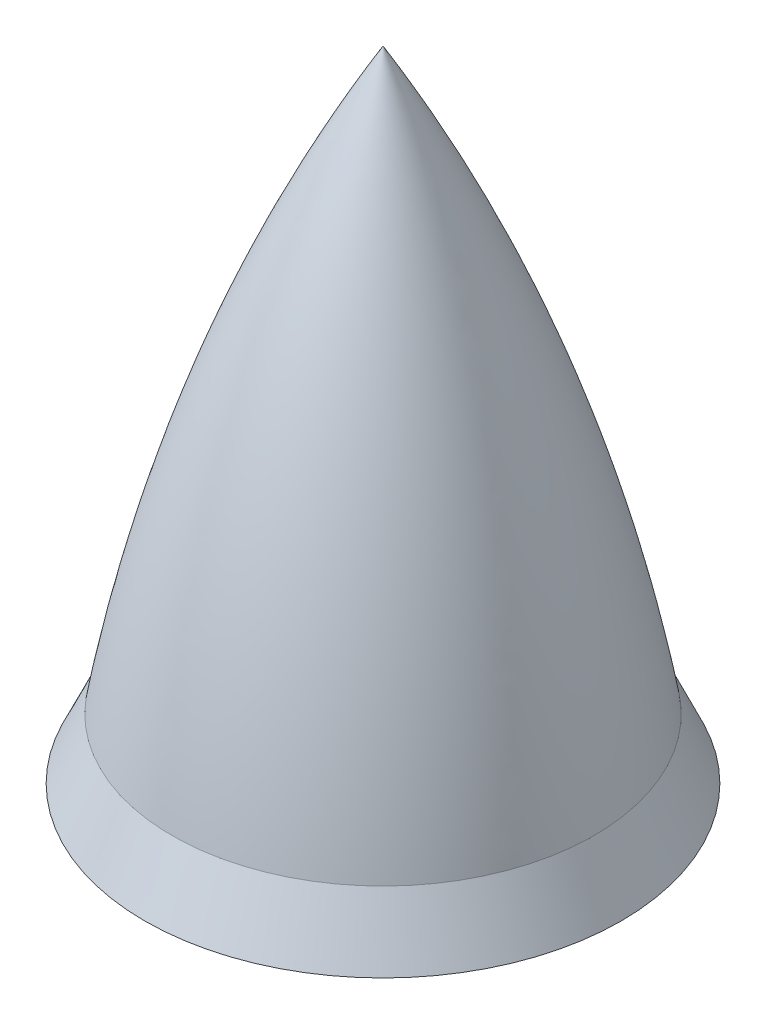
from build123d import *

# Parameters (mm, degrees)
SKETCH2_R          = 2.5
CUT_EXTRUDE1_DEPTH = 5


with BuildPart() as part:
    # Sketch1 → Revolve2 (revolve)
    with BuildSketch(Plane.XY, mode=Mode.PRIVATE) as revolve2_sk:
        with BuildLine():
            Line((0, 0), (-5.93, 0))
            Line((-5.93, 0), (-5.25, 1.5))
            ThreePointArc((-5.25, 1.5), (-3.264641046, 8.933202465), (0, 15.9))
            Line((0, 15.9), (0, 1.5))
            Line((0, 1.5), (0, 0))
        make_face()
    revolve(revolve2_sk.sketch.rotate(Axis((0, 1.5, 0), (0, 1, 0)), 270), axis=Axis((0, 1.5, 0), (0, 1, 0)))

    # Sketch2 → Cut-Extrude1 (cut)
    with BuildSketch(Plane.XZ):
        with Locations(Location((0, 0, 0), (0, 0, 270))):
            Circle(SKETCH2_R)
    extrude(amount=-CUT_EXTRUDE1_DEPTH, mode=Mode.SUBTRACT)


solid = part.part
